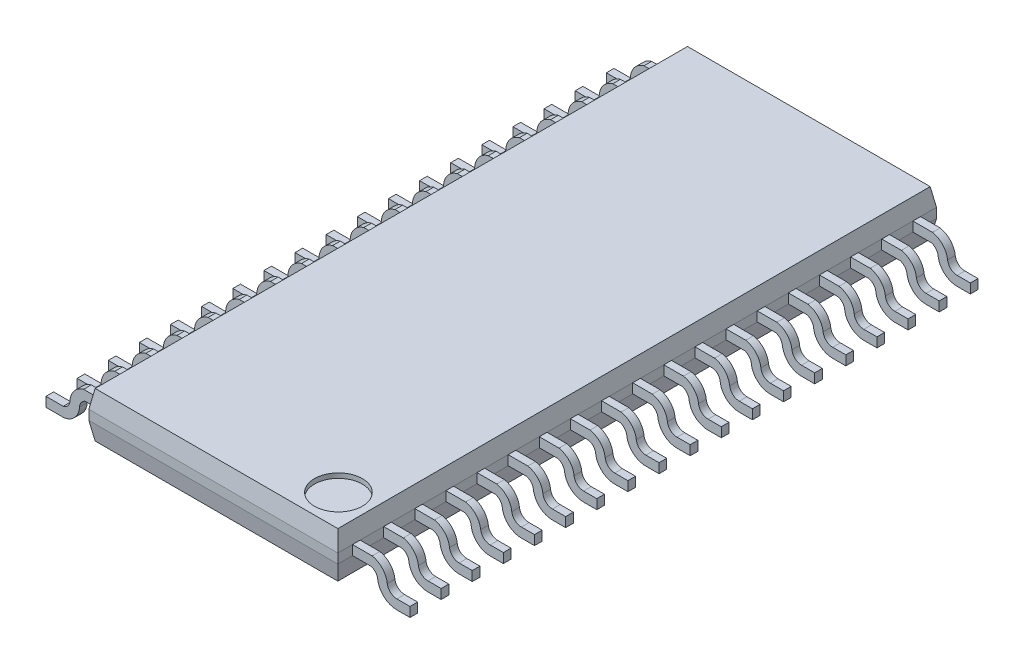
from build123d import *

# Parameters (mm, degrees)
EXTRUDE_THIN1_DEPTH = 0.08
LPATTERN2_COUNT     = 19
LPATTERN2_PITCH     = 0.65
SKETCH16_W          = 5.2
SKETCH16_H          = 12.5
BOSS_EXTRUDE1_DEPTH = 0.1005
SKETCH17_W          = 5.2
SKETCH17_H          = 12.5
BOSS_EXTRUDE2_DEPTH = 0.375
BOSS_EXTRUDE2_TAPER = 10
SKETCH18_R          = 0.5
CUT_EXTRUDE1_DEPTH  = 0.1
SKETCH19_W          = 3.39
SKETCH19_H          = 6.35
CUT_EXTRUDE2_DEPTH  = 0.1


with BuildPart() as part:
    # Sketch1 → Extrude-Thin1 (new, symmetric)
    with BuildSketch(Plane.XY):
        with BuildLine():
            Line((3.8, -0.42), (3.525600379, -0.42))
            ThreePointArc((3.525600379, -0.42), (3.391684602, -0.369025782), (3.325558839, -0.241906982))
            ThreePointArc((3.325558839, -0.241906982), (3.223662825, -0.019797244), (3.010674203, 0.1))
            Line((3.010674203, 0.1), (-3.014821603, 0.1))
            ThreePointArc((-3.014821603, 0.1), (-3.213739111, -0.031405244), (-3.299345426, -0.253907092))
            ThreePointArc((-3.299345426, -0.253907092), (-3.341774466, -0.360341059), (-3.439596875, -0.42))
            Line((-3.439596875, -0.42), (-3.8, -0.42))
            Line((-3.8, -0.42), (-3.8, -0.62))
            Line((-3.8, -0.62), (-3.421132652, -0.62))
            ThreePointArc((-3.421132652, -0.62), (-3.197786833, -0.499455471), (-3.099675121, -0.265386185))
            ThreePointArc((-3.099675121, -0.265386185), (-3.064735761, -0.165806541), (-2.982235072, -0.1))
            Line((-2.982235072, -0.1), (2.987272069, -0.1))
            ThreePointArc((2.987272069, -0.1), (3.081992368, -0.161453368), (3.126901966, -0.265046704))
            ThreePointArc((3.126901966, -0.265046704), (3.258695777, -0.518404403), (3.525600379, -0.62))
            Line((3.525600379, -0.62), (3.8, -0.62))
            Line((3.8, -0.62), (3.8, -0.42))
        make_face()
    extrude(amount=EXTRUDE_THIN1_DEPTH, both=True)


with BuildPart() as lpattern2_1:
    # LPattern2: pattern copy
    add(part.part.moved(Location(Vector(0, 0, -1) * (1 * LPATTERN2_PITCH))))


with BuildPart() as lpattern2_2:
    # LPattern2: pattern copy
    add(part.part.moved(Location(Vector(0, 0, -1) * (2 * LPATTERN2_PITCH))))


with BuildPart() as lpattern2_3:
    # LPattern2: pattern copy
    add(part.part.moved(Location(Vector(0, 0, -1) * (3 * LPATTERN2_PITCH))))


with BuildPart() as lpattern2_4:
    # LPattern2: pattern copy
    add(part.part.moved(Location(Vector(0, 0, -1) * (4 * LPATTERN2_PITCH))))


with BuildPart() as lpattern2_5:
    # LPattern2: pattern copy
    add(part.part.moved(Location(Vector(0, 0, -1) * (5 * LPATTERN2_PITCH))))


with BuildPart() as lpattern2_6:
    # LPattern2: pattern copy
    add(part.part.moved(Location(Vector(0, 0, -1) * (6 * LPATTERN2_PITCH))))


with BuildPart() as lpattern2_7:
    # LPattern2: pattern copy
    add(part.part.moved(Location(Vector(0, 0, -1) * (7 * LPATTERN2_PITCH))))


with BuildPart() as lpattern2_8:
    # LPattern2: pattern copy
    add(part.part.moved(Location(Vector(0, 0, -1) * (8 * LPATTERN2_PITCH))))


with BuildPart() as lpattern2_9:
    # LPattern2: pattern copy
    add(part.part.moved(Location(Vector(0, 0, -1) * (9 * LPATTERN2_PITCH))))


with BuildPart() as lpattern2_10:
    # LPattern2: pattern copy
    add(part.part.moved(Location(Vector(0, 0, -1) * (10 * LPATTERN2_PITCH))))


with BuildPart() as lpattern2_11:
    # LPattern2: pattern copy
    add(part.part.moved(Location(Vector(0, 0, -1) * (11 * LPATTERN2_PITCH))))


with BuildPart() as lpattern2_12:
    # LPattern2: pattern copy
    add(part.part.moved(Location(Vector(0, 0, -1) * (12 * LPATTERN2_PITCH))))


with BuildPart() as lpattern2_13:
    # LPattern2: pattern copy
    add(part.part.moved(Location(Vector(0, 0, -1) * (13 * LPATTERN2_PITCH))))


with BuildPart() as lpattern2_14:
    # LPattern2: pattern copy
    add(part.part.moved(Location(Vector(0, 0, -1) * (14 * LPATTERN2_PITCH))))


with BuildPart() as lpattern2_15:
    # LPattern2: pattern copy
    add(part.part.moved(Location(Vector(0, 0, -1) * (15 * LPATTERN2_PITCH))))


with BuildPart() as lpattern2_16:
    # LPattern2: pattern copy
    add(part.part.moved(Location(Vector(0, 0, -1) * (16 * LPATTERN2_PITCH))))


with BuildPart() as lpattern2_17:
    # LPattern2: pattern copy
    add(part.part.moved(Location(Vector(0, 0, -1) * (17 * LPATTERN2_PITCH))))


with BuildPart() as lpattern2_18:
    # LPattern2: pattern copy
    add(part.part.moved(Location(Vector(0, 0, -1) * (18 * LPATTERN2_PITCH))))


with BuildPart() as part_1:
    add(part.part)

    add(lpattern2_1.part)  # Boss-Extrude1 merges LPattern2_1

    add(lpattern2_2.part)  # Boss-Extrude1 merges LPattern2_2

    add(lpattern2_3.part)  # Boss-Extrude1 merges LPattern2_3

    add(lpattern2_4.part)  # Boss-Extrude1 merges LPattern2_4

    add(lpattern2_5.part)  # Boss-Extrude1 merges LPattern2_5

    add(lpattern2_6.part)  # Boss-Extrude1 merges LPattern2_6

    add(lpattern2_7.part)  # Boss-Extrude1 merges LPattern2_7

    add(lpattern2_8.part)  # Boss-Extrude1 merges LPattern2_8

    add(lpattern2_9.part)  # Boss-Extrude1 merges LPattern2_9

    add(lpattern2_10.part)  # Boss-Extrude1 merges LPattern2_10

    add(lpattern2_11.part)  # Boss-Extrude1 merges LPattern2_11

    add(lpattern2_12.part)  # Boss-Extrude1 merges LPattern2_12

    add(lpattern2_13.part)  # Boss-Extrude1 merges LPattern2_13
    # Sketch16 → Boss-Extrude1 (add, symmetric)
    with BuildSketch(Plane(origin=(0, 0, 0), x_dir=(1, 0, 0), z_dir=(0, 1, 0))):
        with Locations((0, 5.863906666)):
            Rectangle(SKETCH16_W, SKETCH16_H)
    extrude(amount=BOSS_EXTRUDE1_DEPTH, both=True)

    # Sketch17 → Boss-Extrude2 (add)
    with BuildSketch(Plane(origin=(0, 0.1005, 0), x_dir=(1, 0, 0), z_dir=(0, 1, 0))):
        with Locations((0, 5.863906666)):
            Rectangle(SKETCH17_W, SKETCH17_H)
    boss_extrude2 = extrude(amount=BOSS_EXTRUDE2_DEPTH, taper=BOSS_EXTRUDE2_TAPER)

    # Mirror1: Boss-Extrude2 across plane
    add(boss_extrude2.mirror(Plane.ZX))

    # Sketch18 → Cut-Extrude1 (cut)
    with BuildSketch(Plane(origin=(0, 0.4755, 0), x_dir=(1, 0, 0), z_dir=(0, 1, 0))):
        with Locations(Location((1.885478792, 0.340088746, 0), (0, 0, 270))):
            Circle(SKETCH18_R)
    extrude(amount=-CUT_EXTRUDE1_DEPTH, mode=Mode.SUBTRACT)

    # Sketch19 → Cut-Extrude2 (cut)
    with BuildSketch(Plane.XZ.offset(0.4755)):
        with Locations((0, -5.863906666)):
            Rectangle(SKETCH19_W, SKETCH19_H)
    extrude(amount=-CUT_EXTRUDE2_DEPTH, mode=Mode.SUBTRACT)


solid = Compound([lpattern2_14.part, lpattern2_15.part, lpattern2_16.part, lpattern2_17.part, lpattern2_18.part, part_1.part])
